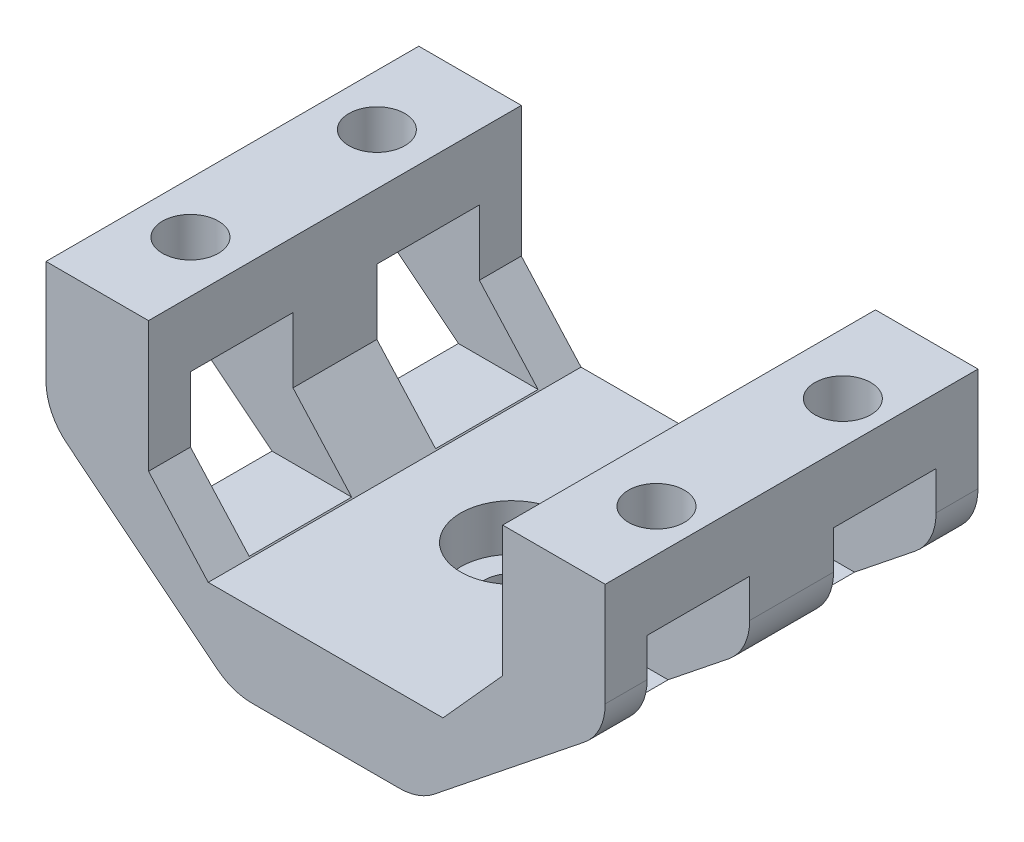
from build123d import *

# Parameters (mm, degrees)
CROQUIS1_W              = 5.5
CROQUIS1_H              = 7
CROQUIS1_W_2            = 5
CROQUIS1_H_2            = 3
SALIENTE_EXTRUIR1_DEPTH = 20
CROQUIS2_W              = 5.5
CROQUIS2_H              = 7
CORTAR_EXTRUIR3_DEPTH   = 37.932370625
CROQUIS3_R              = 1.5
CORTAR_EXTRUIR4_DEPTH   = 33.015621187
REDONDEO1_R             = 3
CROQUIS4_R              = 1.5
CORTAR_EXTRUIR5_DEPTH   = 31.724582991
SALIENTE_EXTRUIR2_DEPTH = 20
CROQUIS9_R              = 2.75
CORTAR_EXTRUIR6_DEPTH   = 2.5


with BuildPart() as part:
    # Croquis1 → Saliente-Extruir1 (new body)
    with BuildSketch(Plane.XY):
        with Locations((-7.25, 3.5)):
            Rectangle(CROQUIS1_W, CROQUIS1_H)
        Polygon((0, -5), (0, -8), (-10, 0), (-4.5, 0), align=None)
        with Locations((2.5, -6.5)):
            Rectangle(CROQUIS1_W_2, CROQUIS1_H_2)
        with Locations((7.5, -6.5)):
            Rectangle(CROQUIS1_W_2, CROQUIS1_H_2)
        Polygon((14.5, 0), (20, 0), (10, -8), (10, -5), align=None)
        with Locations((17.25, 3.5)):
            Rectangle(CROQUIS1_W, CROQUIS1_H)
    extrude(amount=SALIENTE_EXTRUIR1_DEPTH)

    # Croquis2 → Cortar-Extruir3 (cut, through all)
    with BuildSketch(Plane.ZY.offset(10)):
        with Locations((15, 0)):
            Rectangle(CROQUIS2_W, CROQUIS2_H)
        with Locations((5, 0)):
            Rectangle(CROQUIS2_W, CROQUIS2_H)
    extrude(amount=-CORTAR_EXTRUIR3_DEPTH, mode=Mode.SUBTRACT)

    # Croquis3 → Cortar-Extruir4 (cut, through all)
    with BuildSketch(Plane(origin=(0, 7, 0), x_dir=(1, 0, 0), z_dir=(0, 1, 0))):
        with Locations(Location((-7.25, -5, 0), (0, 0, 180))):
            Circle(CROQUIS3_R)
        with Locations(Location((17.75, -5, 0), (0, 0, 180))):
            Circle(CROQUIS3_R)
        with Locations(Location((17.75, -15, 0), (0, 0, 180))):
            Circle(CROQUIS3_R)
        with Locations(Location((-7.25, -15, 0), (0, 0, 180))):
            Circle(CROQUIS3_R)
    extrude(amount=-CORTAR_EXTRUIR4_DEPTH, mode=Mode.SUBTRACT)

    # Redondeo1
    redondeo1_edges = [part.edges().sort_by_distance(p)[0] for p in [
        (20, 0, 18.875),
        (10, -8, 10),
        (0, -8, 10),
        (-10, 0, 18.875),
        (20, 0, 10),
        (20, 0, 1.125),
        (-10, 0, 10),
        (-10, 0, 1.125),
    ]]
    fillet(redondeo1_edges, radius=REDONDEO1_R)

    # Croquis4 → Cortar-Extruir5 (cut, through all)
    with BuildSketch(Plane(origin=(0, -5, 0), x_dir=(1, 0, 0), z_dir=(0, 1, 0))):
        with Locations(Location((5, -10, 0), (0, 0, 180))):
            Circle(CROQUIS4_R)
    extrude(amount=-CORTAR_EXTRUIR5_DEPTH, mode=Mode.SUBTRACT)

    # Croquis8 → Saliente-Extruir2 (add, through all)
    with BuildSketch(Plane(origin=(0, 0, 0), x_dir=(-1, 0, 0), z_dir=(0, 0, -1))):
        Polygon((-5, -5), (0, -5), (1.29685781, -3.559046878), (-5, -3.559046878), align=None)
        Polygon((-10, -5), (-5, -5), (-5, -3.559046878), (-11.29685781, -3.559046878), align=None)
    extrude(amount=-SALIENTE_EXTRUIR2_DEPTH)

    # Croquis9 → Cortar-Extruir6 (cut)
    with BuildSketch(Plane(origin=(0, -3.559046878, 0), x_dir=(1, 0, 0), z_dir=(0, 1, 0))):
        with Locations(Location((5, -10, 0), (0, 0, 180))):
            Circle(CROQUIS9_R)
    extrude(amount=-CORTAR_EXTRUIR6_DEPTH, mode=Mode.SUBTRACT)


solid = part.part
